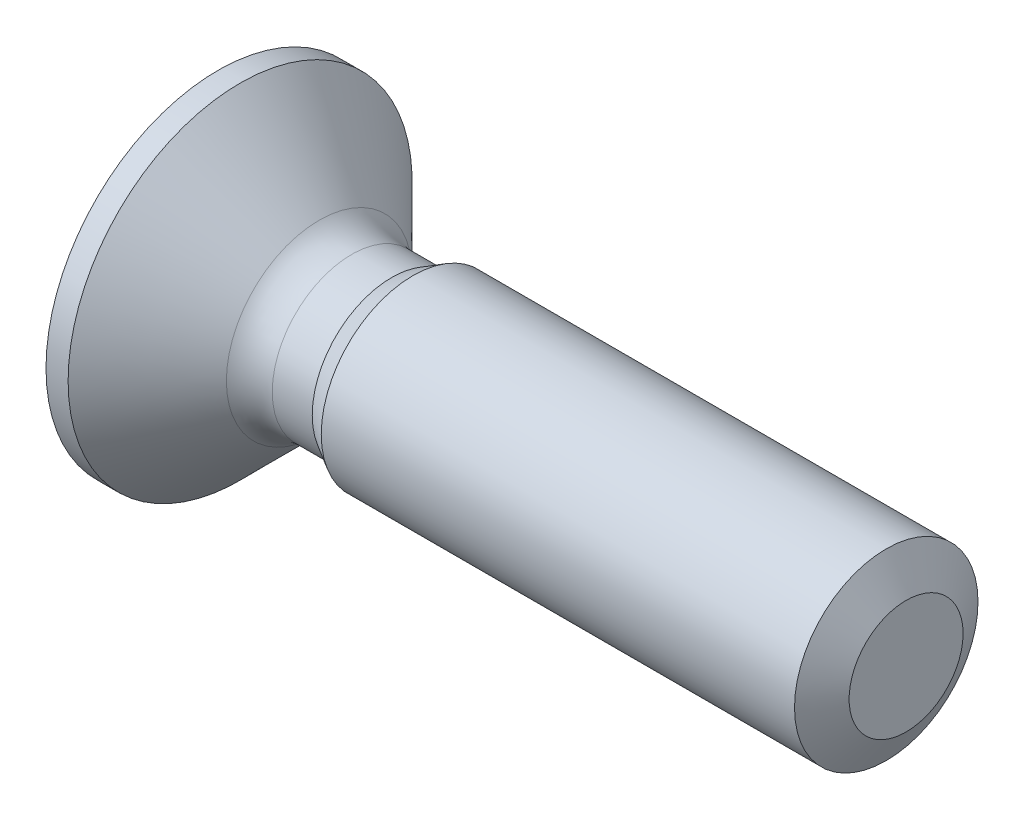
from build123d import *

# Parameters (mm, degrees)
PATTERN_CIRCULAR_1_COUNT = 2
PATTERN_CIRCULAR_1_ANGLE = 90


with BuildPart() as part:
    # 草图1 → Revolve 694 (revolve)
    with BuildSketch(Plane.XY, mode=Mode.PRIVATE) as revolve_694_sk:
        with BuildLine():
            Line((0, 0), (0, 1.5))
            Line((0, 1.5), (0.1928, 1.5))
            Line((0.1928, 1.5), (0.882842712, 0.809957288))
            ThreePointArc((0.882842712, 0.809957288), (1.012612052, 0.723248187), (1.165685425, 0.6928))
            Line((1.165685425, 0.6928), (1.514324153, 0.6928))
            Line((1.514324153, 0.6928), (1.7, 0.8))
            Line((1.7, 0.8), (6, 0.8))
            Line((6, 0.8), (6, 0))
            Line((6, 0), (0, 0))
        make_face()
    revolve(revolve_694_sk.sketch.rotate(Axis((0, 0, 0), (1, 0, 0)), 90), axis=Axis((0, 0, 0), (1, 0, 0)))

    # 草图2 → 切除-旋转1 (revolve, cut)
    with BuildSketch(Plane.XY, mode=Mode.PRIVATE) as cut_revolve_1_sk:
        Polygon((5.826895602, 0.8), (6.176895602, 0.8), (6, 0.4969), align=None)
    revolve(cut_revolve_1_sk.sketch.rotate(Axis((0, 0, 0), (-1, 0, 0)), 270), axis=Axis((0, 0, 0), (-1, 0, 0)), mode=Mode.SUBTRACT)

    # 草图3 → 切除-放样1 section 0
    with BuildSketch(Plane.ZY, mode=Mode.PRIVATE) as loft_1_s0:
        with BuildLine():
            Line((-0.8, 0.175), (0.8, 0.175))
            Line((0.8, 0.175), (0.8, -0.175))
            Line((0.8, -0.175), (-0.8, -0.175))
            Line((-0.8, -0.175), (-0.8, 0.175))
        make_face()
    loft_1 = loft([loft_1_s0.sketch, Vertex(0.9, 0, 0)], mode=Mode.SUBTRACT)

    # 阵列(圆周)1: 切除-放样1 ×2 about axis
    pattern_circular_1_axis = Axis((0, 0, 0), (1, 0, 0))
    for i in range(1, PATTERN_CIRCULAR_1_COUNT):
        add(loft_1.rotate(pattern_circular_1_axis, i * PATTERN_CIRCULAR_1_ANGLE / (PATTERN_CIRCULAR_1_COUNT - 1)), mode=Mode.SUBTRACT)


solid = part.part
